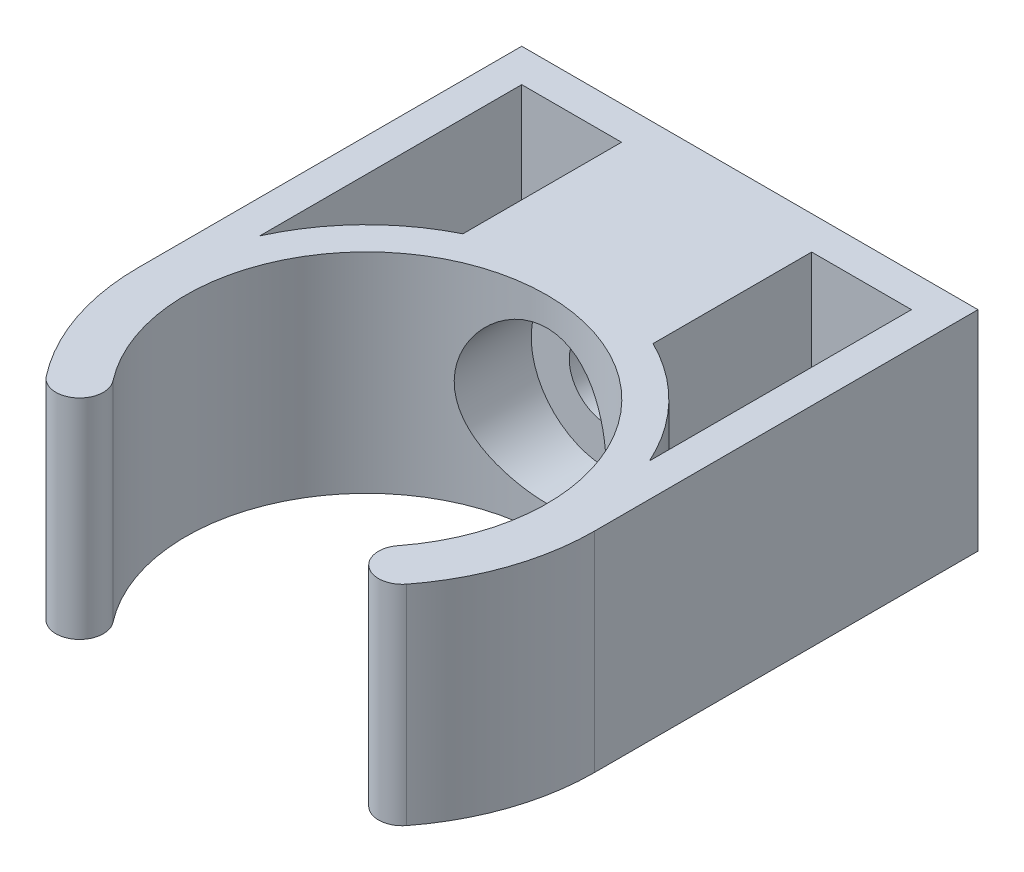
from build123d import *

# Parameters (mm, degrees)
BOSS_EXTRUDE1_DEPTH = 11
SHELL2_T            = -1.75
SKETCH5_W           = 10
SKETCH5_H           = 10.669048105
BOSS_EXTRUDE2_DEPTH = 9.25
HOLE4_D             = 4
HOLE4_DEPTH         = 13
HOLE4_CBORE_D       = 8
HOLE4_CBORE_DEPTH   = 5.5
HOLE4_TIP           = 1.201721238


with BuildPart() as part:
    # Sketch1 → Boss-Extrude1 (new body)
    with BuildSketch(Plane(origin=(0, 0, 0), x_dir=(1, 0, 0), z_dir=(0, 1, 0))):
        with BuildLine():
            Line((-12, -7.169048105), (-12, 13))
            Line((-12, 13), (12, 13))
            Line((12, 13), (12, -7.169048105))
            ThreePointArc((12, -7.169048105), (11.350863635, -11.062362212), (9.473684211, -14.534461025))
            ThreePointArc((9.473684211, -14.534461025), (7.719611593, -14.754072618), (7.5, -13))
            ThreePointArc((7.5, -13), (0, 2.330951895), (-7.5, -13))
            ThreePointArc((-7.5, -13), (-7.719611593, -14.754072618), (-9.473684211, -14.534461025))
            ThreePointArc((-9.473684211, -14.534461025), (-11.350863635, -11.062362212), (-12, -7.169048105))
        make_face()
    extrude(amount=BOSS_EXTRUDE1_DEPTH)

    # Shell2
    shell2_openings = [part.faces().sort_by_distance(p)[0] for p in [
        (0, 11, -3.682863913),
    ]]
    offset(amount=SHELL2_T, openings=shell2_openings, kind=Kind.INTERSECTION)

    # Sketch5 → Boss-Extrude2 (add)
    with BuildSketch(Plane(origin=(0, 11, 0), x_dir=(1, 0, 0), z_dir=(0, 1, 0))):
        with Locations((0, 7.665475948)):
            Rectangle(SKETCH5_W, SKETCH5_H)
    extrude(amount=-BOSS_EXTRUDE2_DEPTH)

    # Hole4
    with Locations(Plane.XY):
        with Locations((0, 5.5)):
            CounterBoreHole(HOLE4_D / 2, HOLE4_CBORE_D / 2, HOLE4_CBORE_DEPTH, depth=HOLE4_DEPTH)
            with Locations((0, 0, -(HOLE4_DEPTH + HOLE4_TIP / 2))):  # 118° drill point
                Cone(0, HOLE4_D / 2, HOLE4_TIP, mode=Mode.SUBTRACT)


solid = part.part
